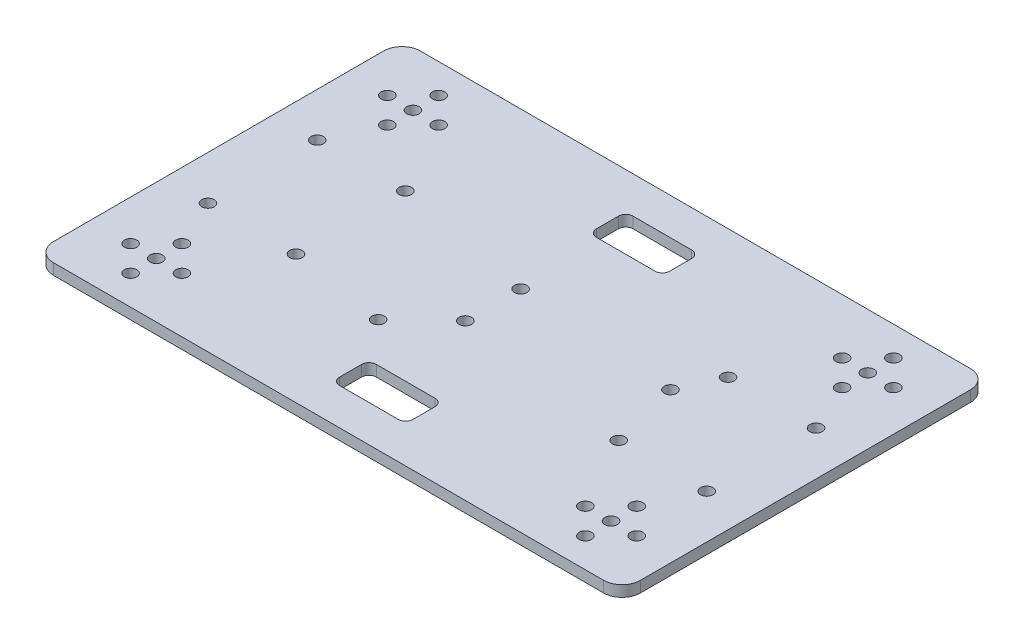
from build123d import *

# Parameters (mm, degrees)
SKETCH1_W                = 160
SKETCH1_H                = 100
BOSS_EXTRUDE1_DEPTH      = 3
M3_CLEARANCE_HOLE1_D     = 3.4
CUT_EXTRUDE1_REACH       = 96.387
SKETCH8_W                = 20
SKETCH8_H                = 10
M3_CLEARANCE_HOLE3_D     = 3.4
M3_CLEARANCE_HOLE4_D     = 3.4
M3_CLEARANCE_HOLE4_DEPTH = 3
FILLET1_R                = 5
FILLET2_R                = 2


with BuildPart() as part:
    # Sketch1 → Boss-Extrude1 (new body)
    with BuildSketch(Plane(origin=(0, 0, 0), x_dir=(1, 0, 0), z_dir=(0, 1, 0))):
        Rectangle(SKETCH1_W, SKETCH1_H)
    extrude(amount=BOSS_EXTRUDE1_DEPTH)

    # M3 Clearance Hole1 (through all)
    with Locations(Plane(origin=(-68, 3, -14.9), x_dir=(0, 0, 1), z_dir=(0, 1, 0))):
        with Locations((0, 0), (0, 24), (29.8, 0), (29.8, 24), (0, 136), (0, 112), (29.8, 112), (29.8, 136)):
            Hole(M3_CLEARANCE_HOLE1_D / 2)

    # Sketch8 → Cut-Extrude1 (cut, up to next)
    with BuildSketch(Plane(origin=(0, 3, 0), x_dir=(1, 0, 0), z_dir=(0, 1, 0)), mode=Mode.PRIVATE) as cut_extrude1_sk1:
        with Locations((1, -35)):
            Rectangle(SKETCH8_W, SKETCH8_H)
    cut_extrude1_tool1 = extrude(cut_extrude1_sk1.sketch, amount=-CUT_EXTRUDE1_REACH, mode=Mode.PRIVATE) & part.part
    # Sketch8 → Cut-Extrude1 (cut, up to next)
    with BuildSketch(Plane(origin=(0, 3, 0), x_dir=(1, 0, 0), z_dir=(0, 1, 0)), mode=Mode.PRIVATE) as cut_extrude1_sk2:
        with Locations((1, 35)):
            Rectangle(SKETCH8_W, SKETCH8_H)
    cut_extrude1_tool2 = extrude(cut_extrude1_sk2.sketch, amount=-CUT_EXTRUDE1_REACH, mode=Mode.PRIVATE) & part.part
    add(cut_extrude1_tool1.solids().sort_by_distance((1, 3, 35))[0], mode=Mode.SUBTRACT)
    add(cut_extrude1_tool2.solids().sort_by_distance((1, 3, -35))[0], mode=Mode.SUBTRACT)

    # M3 Clearance Hole3 (through all)
    with Locations(Plane(origin=(0, 3, 0), x_dir=(1, 0, 0), z_dir=(0, 1, 0))):
        with Locations((-5.121033698, 7.476676114), (-5.143854766, -7.584150602)):
            Hole(M3_CLEARANCE_HOLE3_D / 2)

    # M3 Clearance Hole4
    with Locations(Plane(origin=(0, 3, 0), x_dir=(1, 0, 0), z_dir=(0, 1, 0))):
        with Locations((-62, 35), (-62, 42), (-69, 35), (-62, 28), (-55, 35), (-62, -42), (-69, -35), (-62, -28), (-55, -35), (-62, -35), (-17.29999936, -19.19999912), (39.0999996, 4.1), (-5.121033698, 7.476676114), (-5.143854766, -7.584150602), (62, -35), (69, -35), (62, -42), (55, -35), (62, -28), (69, 35), (62, 35), (62, 42), (55, 35), (62, 28)):
            Hole(M3_CLEARANCE_HOLE4_D / 2, depth=M3_CLEARANCE_HOLE4_DEPTH)

    # Fillet1
    fillet1_edges = [part.edges().sort_by_distance(p)[0] for p in [
        (80, 1.5, 50),
        (-80, 1.5, 50),
        (-80, 1.5, -50),
        (80, 1.5, -50),
    ]]
    fillet(fillet1_edges, radius=FILLET1_R)

    # Fillet2
    fillet2_edges = [part.edges().sort_by_distance(p)[0] for p in [
        (-9, 1.5, 40),
        (-9, 1.5, 30),
        (11, 1.5, 30),
        (11, 1.5, 40),
        (-9, 1.5, -30),
        (-9, 1.5, -40),
        (11, 1.5, -40),
        (11, 1.5, -30),
    ]]
    fillet(fillet2_edges, radius=FILLET2_R)


solid = part.part
